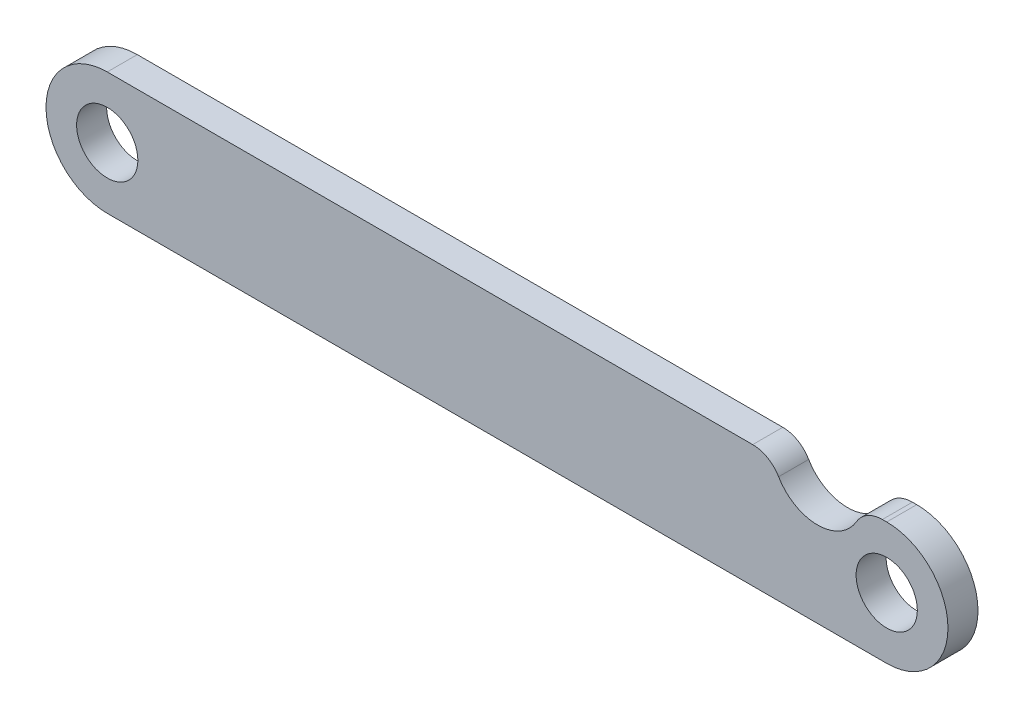
from build123d import *

# Parameters (mm, degrees)
SKETCH1_R          = 1.01901554
EXTRUDE1_DEPTH     = 1
SKETCH2_R          = 1.5
CUT_EXTRUDE2_DEPTH = 29.071089649
FILLET1_R          = 1


with BuildPart() as part:
    # Sketch1 → Extrude1 (new body)
    with BuildSketch(Plane.XY):
        with BuildLine():
            Line((0, 2.038031079), (-25.941113, 2.038031079))
            ThreePointArc((-25.941113, 2.038031079), (-27.979144079, 0), (-25.941113, -2.038031079))
            Line((-25.941113, -2.038031079), (0, -2.038031079))
            ThreePointArc((0, -2.038031079), (2.038031079, 0), (0, 2.038031079))
        make_face()
        with Locations((-25.941113, 0)):
            Circle(SKETCH1_R, mode=Mode.SUBTRACT)
        Circle(SKETCH1_R, mode=Mode.SUBTRACT)
    extrude(amount=EXTRUDE1_DEPTH)

    # Sketch2 → Cut-Extrude2 (cut, through all)
    with BuildSketch(Plane.XY):
        with Locations((-2.302162805, 2.3)):
            Circle(SKETCH2_R)
    extrude(amount=CUT_EXTRUDE2_DEPTH, mode=Mode.SUBTRACT)

    # Fillet1
    fillet1_edges = [part.edges().sort_by_distance(p)[0] for p in [
        (-0.825215858, 2.038031079, 0.5),
        (-3.779109752, 2.038031079, 0.5),
    ]]
    fillet(fillet1_edges, radius=FILLET1_R)


solid = part.part
